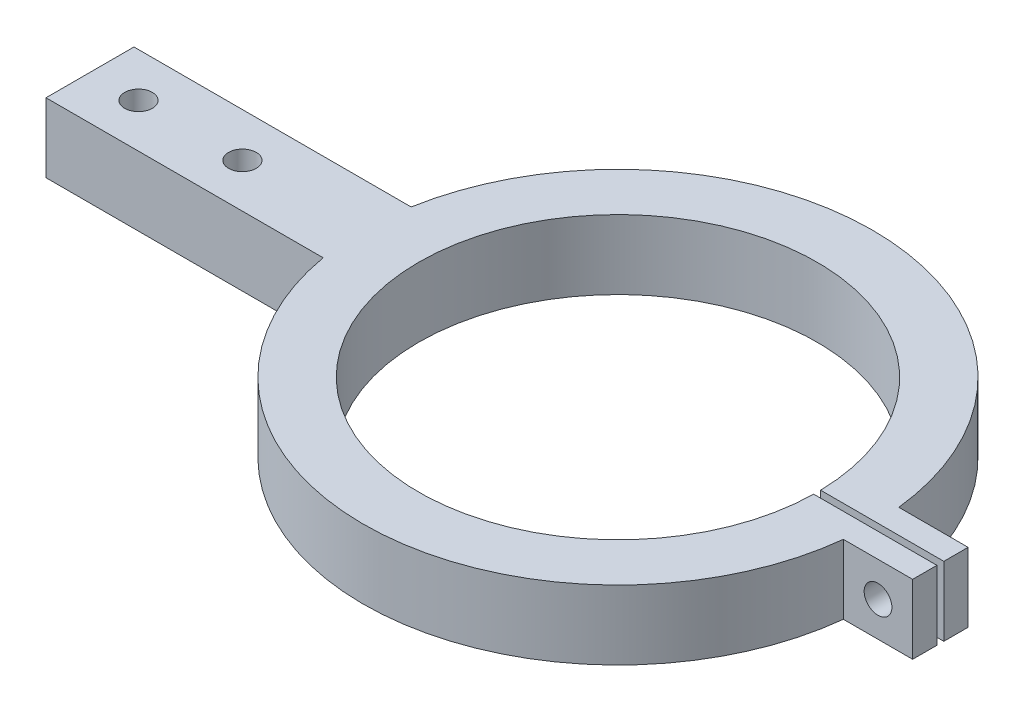
from build123d import *

# Parameters (mm, degrees)
SKETCH1_R           = 2
BOSS_EXTRUDE2_DEPTH = 10
SKETCH2_R           = 2
CUT_EXTRUDE1_DEPTH  = 87.986099448


with BuildPart() as part:
    # Sketch1 → Boss-Extrude2 (new body)
    with BuildSketch(Plane(origin=(0, 0, 0), x_dir=(1, 0, 0), z_dir=(0, 1, 0))):
        with BuildLine():
            Line((-76.197237464, -6.35), (-36.197237464, -6.35))
            ThreePointArc((-36.197237464, -6.35), (1.186838378, -36.730830574), (36.531664348, -4))
            Line((36.531664348, -4), (46.531664348, -4))
            Line((46.531664348, -4), (46.531664348, -0.5))
            Line((46.531664348, -0.5), (28.745651845, -0.5))
            ThreePointArc((28.745651845, -0.5), (-28.75, 0), (28.745651845, 0.5))
            Line((28.745651845, 0.5), (46.531664348, 0.5))
            Line((46.531664348, 0.5), (46.531664348, 4))
            Line((46.531664348, 4), (36.531664348, 4))
            ThreePointArc((36.531664348, 4), (1.186838378, 36.730830574), (-36.197237464, 6.35))
            Line((-36.197237464, 6.35), (-76.197237464, 6.35))
            Line((-76.197237464, 6.35), (-76.197237464, -6.35))
        make_face()
        with Locations(Location((-69.197237464, 0, 0), (0, 0, 270))):
            Circle(SKETCH1_R, mode=Mode.SUBTRACT)
        with Locations(Location((-54.197237464, 0, 0), (0, 0, 270))):
            Circle(SKETCH1_R, mode=Mode.SUBTRACT)
    extrude(amount=BOSS_EXTRUDE2_DEPTH)

    # Sketch2 → Cut-Extrude1 (cut, through all)
    with BuildSketch(Plane.XY.offset(4)):
        with Locations((41.531664348, 5)):
            Circle(SKETCH2_R)
    extrude(amount=-CUT_EXTRUDE1_DEPTH, mode=Mode.SUBTRACT)


solid = part.part
